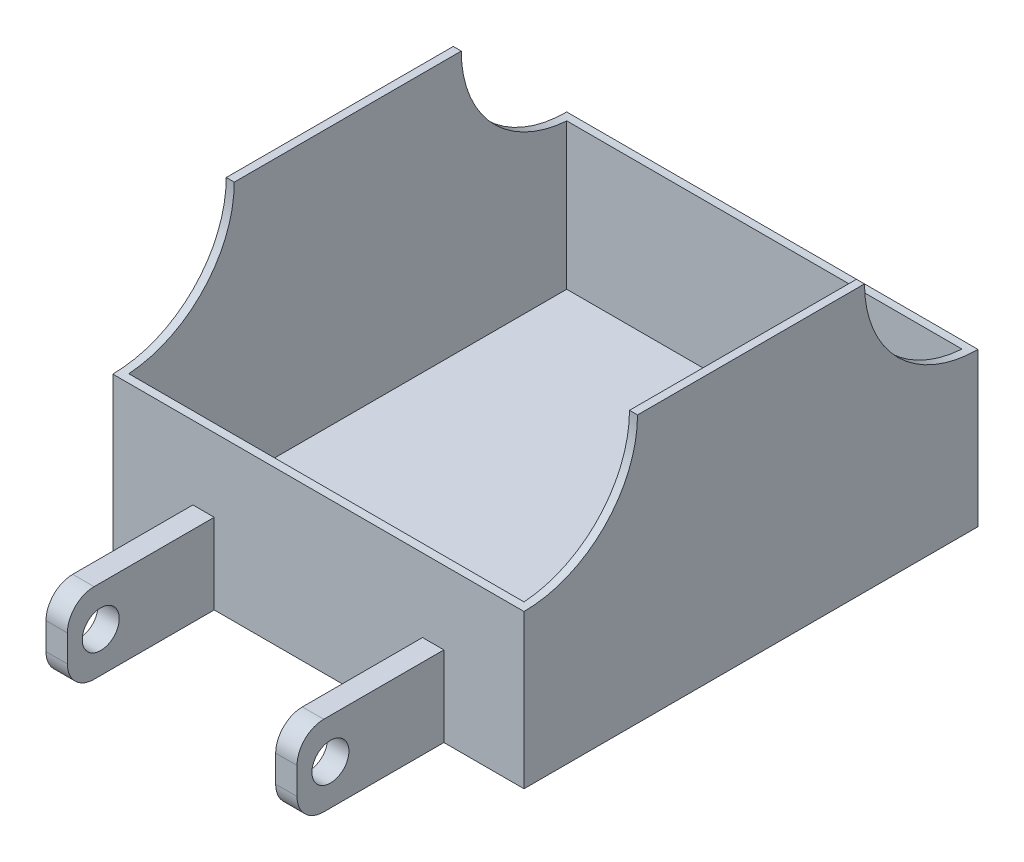
from build123d import *

# Parameters (mm, degrees)
SKETCH2_W           = 170
SKETCH2_H           = 100
BOSS_EXTRUDE5_DEPTH = 154
SHELL1_T            = -3
SKETCH6_W           = 94
SKETCH6_H           = 30.059246991
BOSS_EXTRUDE6_DEPTH = 55
SKETCH7_W           = 78
SKETCH7_H           = 30.059246991
CUT_EXTRUDE3_DEPTH  = 55
SKETCH8_R           = 6.925
CUT_EXTRUDE5_DEPTH  = 94
FILLET1_R           = 10
CUT_EXTRUDE6_REACH  = 216.047
SKETCH9_R           = 42.5


with BuildPart() as part:
    # Sketch2 → Boss-Extrude5 (new body)
    with BuildSketch(Plane(origin=(0, 0, 0), x_dir=(0, 0, -1), z_dir=(1, 0, 0))):
        Rectangle(SKETCH2_W, SKETCH2_H)
    extrude(amount=BOSS_EXTRUDE5_DEPTH)

    # Shell1
    shell1_openings = [part.faces().sort_by_distance(p)[0] for p in [
        (77, 50, 0),
    ]]
    offset(amount=SHELL1_T, openings=shell1_openings, kind=Kind.INTERSECTION)

    # Sketch6 → Boss-Extrude6 (add)
    with BuildSketch(Plane.XY.offset(85)):
        with Locations((77, -34.970376505)):
            Rectangle(SKETCH6_W, SKETCH6_H)
    extrude(amount=BOSS_EXTRUDE6_DEPTH)

    # Sketch7 → Cut-Extrude3 (cut)
    with BuildSketch(Plane.XY.offset(140)):
        with Locations((77, -34.970376505)):
            Rectangle(SKETCH7_W, SKETCH7_H)
    extrude(amount=-CUT_EXTRUDE3_DEPTH, mode=Mode.SUBTRACT)

    # Sketch8 → Cut-Extrude5 (cut)
    with BuildSketch(Plane(origin=(124, 0, 0), x_dir=(0, 0, -1), z_dir=(1, 0, 0))):
        with Locations((-127.5, -34.970376505)):
            Circle(SKETCH8_R)
    extrude(amount=-CUT_EXTRUDE5_DEPTH, mode=Mode.SUBTRACT)

    # Fillet1
    fillet1_edges = [part.edges().sort_by_distance(p)[0] for p in [
        (34, -19.940753009, 140),
        (34, -50, 140),
        (120, -50, 140),
        (120, -19.940753009, 140),
    ]]
    fillet(fillet1_edges, radius=FILLET1_R)

    # Cut-Extrude6: up to this face of the body (flat: up to its plane)
    cut_extrude6_end = Plane(part.part.faces().sort_by_distance((0, 0, 0))[0])
    # Sketch9 → Cut-Extrude6 (cut, up to the picked face)
    with BuildSketch(Plane(origin=(154, 0, 0), x_dir=(0, 0, -1), z_dir=(1, 0, 0)), mode=Mode.PRIVATE) as cut_extrude6_sk1:
        with Locations((85, 50)):
            Circle(SKETCH9_R)
    cut_extrude6_tool1 = split(extrude(cut_extrude6_sk1.sketch, amount=-CUT_EXTRUDE6_REACH, mode=Mode.PRIVATE), bisect_by=cut_extrude6_end, keep=Keep.BOTH, mode=Mode.PRIVATE)
    # Sketch9 → Cut-Extrude6 (cut, up to the picked face)
    with BuildSketch(Plane(origin=(154, 0, 0), x_dir=(0, 0, -1), z_dir=(1, 0, 0)), mode=Mode.PRIVATE) as cut_extrude6_sk2:
        with Locations((-85, 50)):
            Circle(SKETCH9_R)
    cut_extrude6_tool2 = split(extrude(cut_extrude6_sk2.sketch, amount=-CUT_EXTRUDE6_REACH, mode=Mode.PRIVATE), bisect_by=cut_extrude6_end, keep=Keep.BOTH, mode=Mode.PRIVATE)
    add(cut_extrude6_tool1.solids().sort_by(Axis((154, 50, -85), (-1, 0, 0)))[0], mode=Mode.SUBTRACT)
    add(cut_extrude6_tool2.solids().sort_by(Axis((154, 50, 85), (-1, 0, 0)))[0], mode=Mode.SUBTRACT)


solid = part.part
